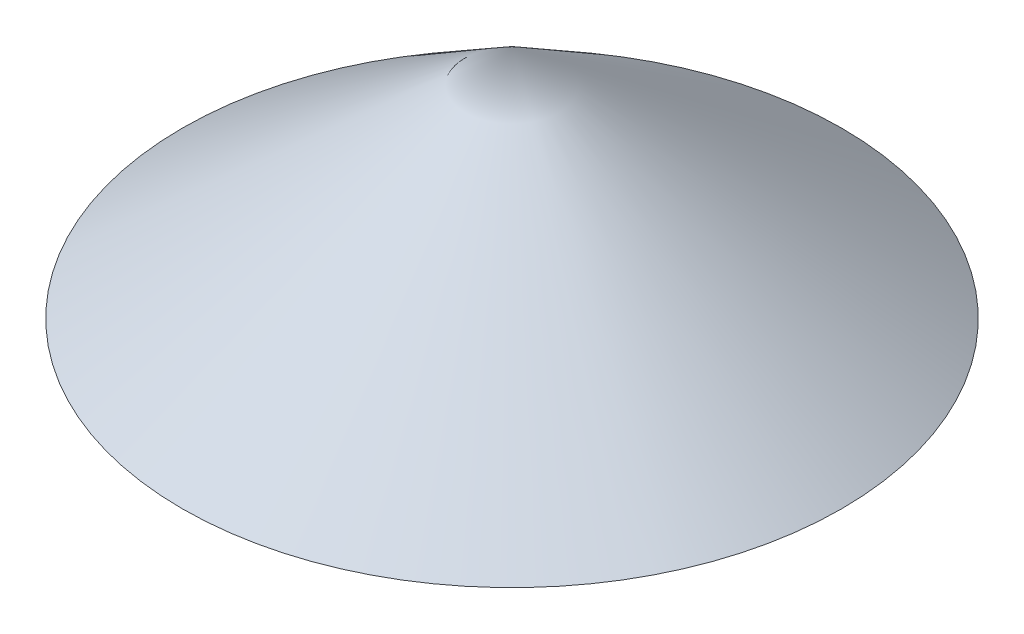
from build123d import *


with BuildPart() as part:
    # Sketch1 → Revolve1 (revolve)
    with BuildSketch(Plane.XY, mode=Mode.PRIVATE) as revolve1_sk:
        Polygon((0, 0), (0, 254), (355.6, 0), align=None)
    revolve(revolve1_sk.sketch.rotate(Axis((0, 0, 0), (0, 1, 0)), 90), axis=Axis((0, 0, 0), (0, 1, 0)))

    # Sketch2 → Cut-Revolve1 (revolve, cut)
    with BuildSketch(Plane.XY, mode=Mode.PRIVATE) as cut_revolve1_sk:
        Polygon((0, 0), (0, 253.365), (354.965, 0), align=None)
    revolve(cut_revolve1_sk.sketch.rotate(Axis((0, 0, 0), (0, 1, 0)), 90), axis=Axis((0, 0, 0), (0, 1, 0)), mode=Mode.SUBTRACT)


solid = part.part
